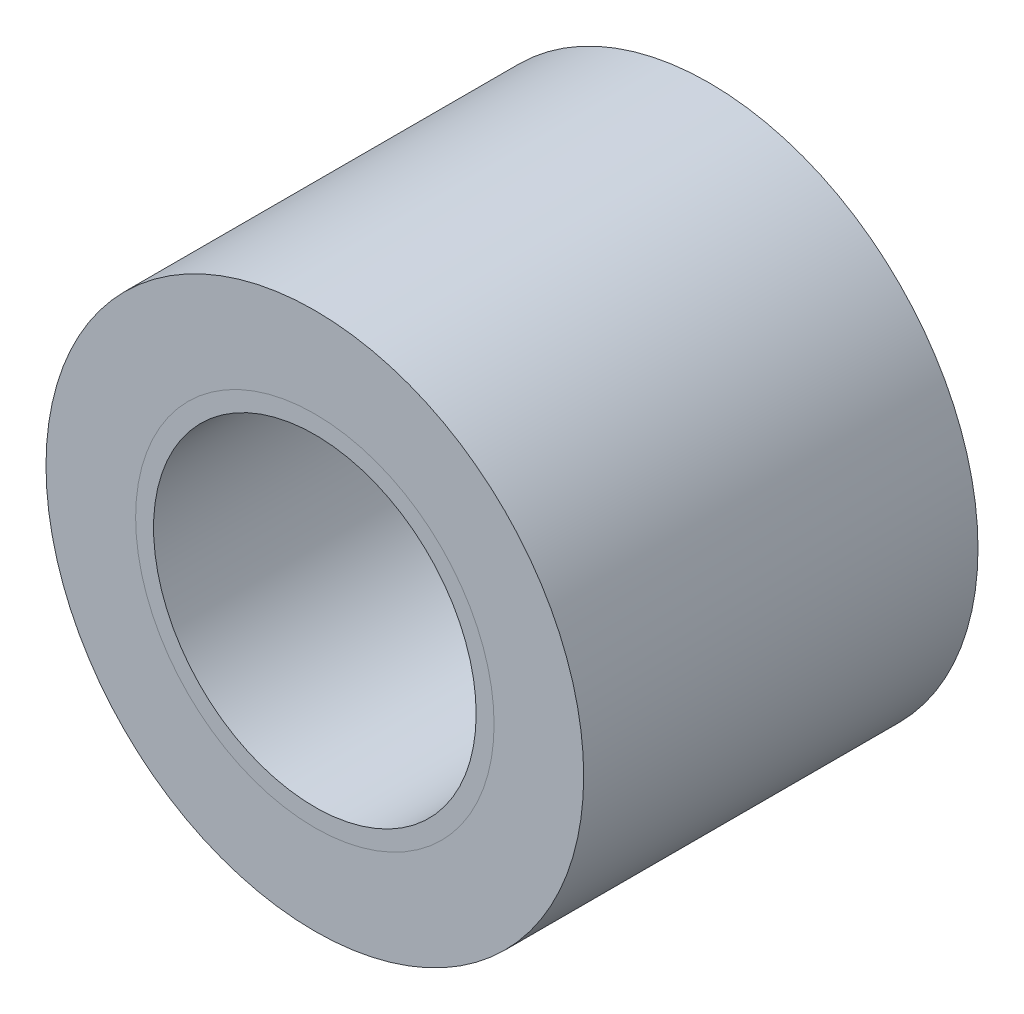
from build123d import *

# Parameters (mm, degrees)
ESQUISSE1_R             = 15
ESQUISSE1_R_2           = 10
BOSS_EXTRU_1_DEPTH      = 22
ESQUISSE1_3_R           = 10
ESQUISSE1_3_R_2         = 9
BOSS_EXTRU_2_DEPTH      = 22
ESQUISSE1_4_R           = 9
BOSS_EXTRU_3_DEPTH      = 7.5
ESQUISSE2_R             = 1.5
ENL_V_MAT_EXTRU_1_DEPTH = 31.56141358


with BuildPart() as part:
    # Esquisse1 → Boss.-Extru.1 (new body)
    with BuildSketch(Plane.XY):
        Circle(ESQUISSE1_R)
        Circle(ESQUISSE1_R_2, mode=Mode.SUBTRACT)
    extrude(amount=BOSS_EXTRU_1_DEPTH)


with BuildPart() as body_2:
    # Esquisse1<3> → Boss.-Extru.2 (new body)
    with BuildSketch(Plane.XY):
        Circle(ESQUISSE1_3_R)
        Circle(ESQUISSE1_3_R_2, mode=Mode.SUBTRACT)
    extrude(amount=BOSS_EXTRU_2_DEPTH)


with BuildPart() as body_3:
    # Esquisse1<4> → Boss.-Extru.3 (new body)
    with BuildSketch(Plane.XY):
        Circle(ESQUISSE1_4_R)
    extrude(amount=BOSS_EXTRU_3_DEPTH)

    # Esquisse2 → Enlèv. mat.-Extru.1 (cut, through all)
    with BuildSketch(Plane(origin=(0, 0, 0), x_dir=(-1, 0, 0), z_dir=(0, 0, -1))):
        Circle(ESQUISSE2_R)
    extrude(amount=-ENL_V_MAT_EXTRU_1_DEPTH, mode=Mode.SUBTRACT)


solid = Compound([part.part, body_2.part, body_3.part])
